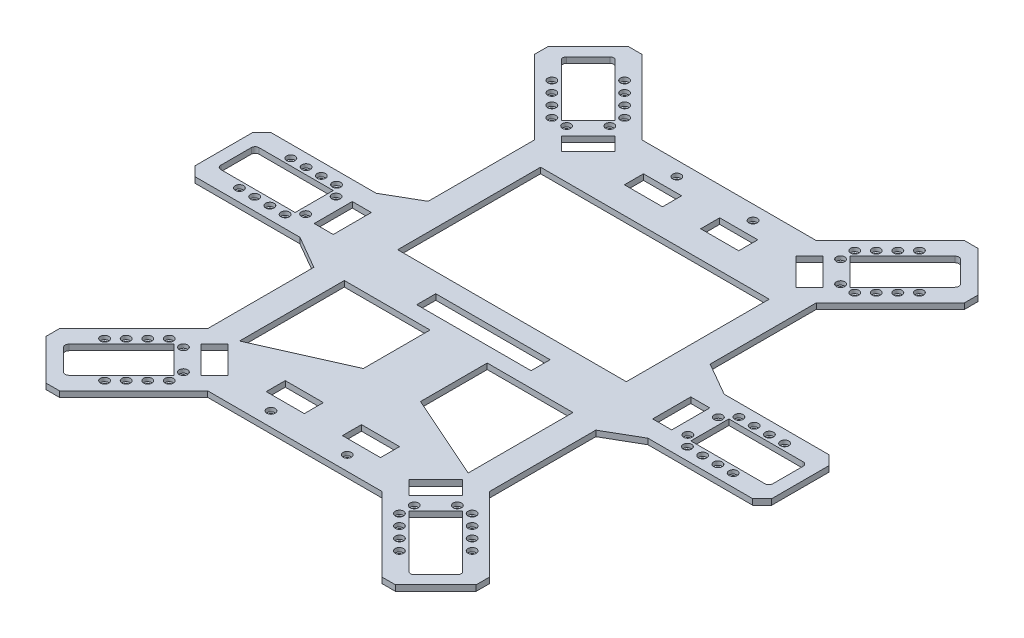
from build123d import *

# Parameters (mm, degrees)
EXTRUDE_1_DEPTH              = 3
CUT_EXTRUDE_1_REACH          = 217.134
HOLE_WIZARD_M2_2_D           = 2.4
HOLE_WIZARD_M2_2_CBORE_D     = 4.4
HOLE_WIZARD_M2_2_CBORE_DEPTH = 2
CUT_EXTRUDE_2_REACH          = 217.134
HOLE_WIZARD_M2_3_D           = 2.4
HOLE_WIZARD_M2_3_CBORE_D     = 4.4
HOLE_WIZARD_M2_3_CBORE_DEPTH = 2
MIRROR_7_COPY_1_REACH        = 217.134
MIRROR_7_COPY_2_D            = 2.4
MIRROR_7_COPY_2_CBORE_D      = 4.4
MIRROR_7_COPY_2_CBORE_DEPTH  = 2
CUT_EXTRUDE_3_REACH          = 217.134
SKETCH_19_W                  = 20
SKETCH_19_H                  = 10
SKETCH_19_W_2                = 120
SKETCH_19_H_2                = 75
SKETCH_19_W_3                = 60
CUT_EXTRUDE_4_REACH          = 217.134
SKETCH_20_W                  = 10
SKETCH_20_H                  = 20
HOLE_WIZARD_M2_4_D           = 2.4
HOLE_WIZARD_M2_4_CBORE_D     = 4.4
HOLE_WIZARD_M2_4_CBORE_DEPTH = 2


with BuildPart() as part:
    # 草图1 → 凸台-拉伸1 (new body)
    with BuildSketch(Plane(origin=(0, 0, 0), x_dir=(1, 0, 0), z_dir=(0, 1, 0))):
        Polygon((-45.715728753, 114), (45.715728753, 114), (84.606601718, 152.890872965), (91.67766953, 152.890872965), (112.890872965, 131.67766953), (112.890872965, 124.606601718), (74, 85.715728753), (74, 30), (91.320508076, 20), (146.320508076, 20), (151.320508076, 15), (151.320508076, -15), (146.320508076, -20), (91.320508076, -20), (74, -30), (74, -85.715728753), (112.890872965, -124.606601718), (112.890872965, -131.67766953), (91.67766953, -152.890872965), (84.606601718, -152.890872965), (45.715728753, -114), (-45.715728753, -114), (-84.606601718, -152.890872965), (-91.67766953, -152.890872965), (-112.890872965, -131.67766953), (-112.890872965, -124.606601718), (-74, -85.715728753), (-74, -30), (-91.320508076, -20), (-146.320508076, -20), (-151.320508076, -15), (-151.320508076, 15), (-146.320508076, 20), (-91.320508076, 20), (-74, 30), (-74, 85.715728753), (-112.890872965, 124.606601718), (-112.890872965, 131.67766953), (-91.67766953, 152.890872965), (-84.606601718, 152.890872965), align=None)
    extrude(amount=EXTRUDE_1_DEPTH)

    # 草图2 → 切除-拉伸1 (cut, up to next)
    with BuildSketch(Plane(origin=(0, 3, 0), x_dir=(1, 0, 0), z_dir=(0, 1, 0)), mode=Mode.PRIVATE) as cut_extrude_1_sk1:
        with BuildLine():
            Line((103.820508076, -10), (103.820508076, 10))
            Line((103.820508076, 10), (142.820508076, 10))
            ThreePointArc((142.820508076, 10), (144.234721638, 9.414213562), (144.820508076, 8))
            Line((144.820508076, 8), (144.820508076, -8))
            ThreePointArc((144.820508076, -8), (144.234721638, -9.414213562), (142.820508076, -10))
            Line((142.820508076, -10), (103.820508076, -10))
        make_face()
    cut_extrude_1_tool1 = extrude(cut_extrude_1_sk1.sketch, amount=-CUT_EXTRUDE_1_REACH, mode=Mode.PRIVATE) & part.part
    cut_extrude_1 = cut_extrude_1_tool1.solids().sort_by_distance((124.278435, 3, 0))[0]
    add(cut_extrude_1, mode=Mode.SUBTRACT)

    # M2 凹头盖螺钉的柱形沉头孔2 (through all)
    with Locations(Plane(origin=(100.320508076, 3, -8), x_dir=(0, 0, 1), z_dir=(0, 1, 0))):
        with Locations((0, 0), (-5.5, 5.25), (-5.5, 13.25), (-5.5, 21.25), (-5.5, 29.25), (16, 0), (21.5, 5.25), (21.5, 13.25), (21.5, 21.25), (21.5, 29.25)):
            hole_wizard_m2_2 = CounterBoreHole(HOLE_WIZARD_M2_2_D / 2, HOLE_WIZARD_M2_2_CBORE_D / 2, HOLE_WIZARD_M2_2_CBORE_DEPTH)

    # 草图10 → 切除-拉伸2 (cut, up to next)
    with BuildSketch(Plane(origin=(0, 3, 0), x_dir=(1, 0, 0), z_dir=(0, 1, 0)), mode=Mode.PRIVATE) as cut_extrude_2_sk1:
        with BuildLine():
            Line((75.767766953, 101.625631329), (61.625631329, 115.767766953))
            Line((61.625631329, 115.767766953), (89.202795796, 143.344931419))
            ThreePointArc((89.202795796, 143.344931419), (90.617009358, 143.930717857), (92.03122292, 143.344931419))
            Line((92.03122292, 143.344931419), (103.344931419, 132.03122292))
            ThreePointArc((103.344931419, 132.03122292), (103.930717857, 130.617009358), (103.344931419, 129.202795796))
            Line((103.344931419, 129.202795796), (75.767766953, 101.625631329))
        make_face()
    cut_extrude_2_tool1 = extrude(cut_extrude_2_sk1.sketch, amount=-CUT_EXTRUDE_2_REACH, mode=Mode.PRIVATE) & part.part
    cut_extrude_2 = cut_extrude_2_tool1.solids().sort_by_distance((83.162638, 3, -123.162638))[0]
    add(cut_extrude_2, mode=Mode.SUBTRACT)

    # M2 凹头盖螺钉的柱形沉头孔3 (through all)
    with Locations(Plane(origin=(60.388194462, 3, -119.480077554), x_dir=(0, 0, 1), z_dir=(0, 1, 0))):
        with Locations((0, 0), (-5.65685425, 5.65685425), (-11.313708499, 11.313708499), (-16.970562749, 16.970562749), (7.601397898, 0.176776695), (18.915106397, 11.490485194), (19.091883092, 19.091883092), (13.435028842, 24.748737342), (7.778174593, 30.405591591), (2.121320343, 36.062445841)):
            hole_wizard_m2_3 = CounterBoreHole(HOLE_WIZARD_M2_3_D / 2, HOLE_WIZARD_M2_3_CBORE_D / 2, HOLE_WIZARD_M2_3_CBORE_DEPTH)

    # 镜向5: 切除-拉伸1, M2 凹头盖螺钉的柱形沉头孔2 across plane
    add(cut_extrude_1.mirror(Plane(origin=(0, 0, 0), x_dir=(0, 0, 1), z_dir=(1, 0, 0))), mode=Mode.SUBTRACT)
    add(hole_wizard_m2_2.mirror(Plane(origin=(0, 0, 0), x_dir=(0, 0, 1), z_dir=(1, 0, 0))), mode=Mode.SUBTRACT)

    # 镜向6: 切除-拉伸2, M2 凹头盖螺钉的柱形沉头孔3 across plane
    add(cut_extrude_2.mirror(Plane(origin=(0, 0, 0), x_dir=(0, 0, 1), z_dir=(1, 0, 0))), mode=Mode.SUBTRACT)
    add(hole_wizard_m2_3.mirror(Plane(origin=(0, 0, 0), x_dir=(0, 0, 1), z_dir=(1, 0, 0))), mode=Mode.SUBTRACT)

    # 镜向7: 切除-拉伸2, M2 凹头盖螺钉的柱形沉头孔3 across plane
    add(cut_extrude_2.mirror(Plane.XY), mode=Mode.SUBTRACT)
    add(hole_wizard_m2_3.mirror(Plane.XY), mode=Mode.SUBTRACT)

    # 镜向7 copy 1 sketch → 镜向7 copy 1 (cut, up to next)
    with BuildSketch(Plane(origin=(0, 3, 0), x_dir=(-1, 0, 0), z_dir=(0, 1, 0)), mode=Mode.PRIVATE) as mirror_7_copy_1_sk1:
        with BuildLine():
            Line((75.767766953, 101.625631329), (61.625631329, 115.767766953))
            Line((61.625631329, 115.767766953), (89.202795796, 143.344931419))
            ThreePointArc((89.202795796, 143.344931419), (90.617009358, 143.930717857), (92.03122292, 143.344931419))
            Line((92.03122292, 143.344931419), (103.344931419, 132.03122292))
            ThreePointArc((103.344931419, 132.03122292), (103.930717857, 130.617009358), (103.344931419, 129.202795796))
            Line((103.344931419, 129.202795796), (75.767766953, 101.625631329))
        make_face()
    mirror_7_copy_1_tool1 = extrude(mirror_7_copy_1_sk1.sketch, amount=-MIRROR_7_COPY_1_REACH, mode=Mode.PRIVATE) & part.part
    add(mirror_7_copy_1_tool1.solids().sort_by_distance((-83.162638, 3, 123.162638))[0], mode=Mode.SUBTRACT)

    # 镜向7 copy 2 (through all)
    with Locations(Plane(origin=(-60.388194462, 3, 119.480077554), x_dir=(0, 0, -1), z_dir=(0, 1, 0))):
        with Locations((0, 0), (-5.65685425, 5.65685425), (-11.313708499, 11.313708499), (-16.970562749, 16.970562749), (7.601397898, 0.176776695), (18.915106397, 11.490485194), (19.091883092, 19.091883092), (13.435028842, 24.748737342), (7.778174593, 30.405591591), (2.121320343, 36.062445841)):
            CounterBoreHole(MIRROR_7_COPY_2_D / 2, MIRROR_7_COPY_2_CBORE_D / 2, MIRROR_7_COPY_2_CBORE_DEPTH)

    # 草图19 → 切除-拉伸3 (cut, up to next)
    with BuildSketch(Plane(origin=(0, 3, 0), x_dir=(1, 0, 0), z_dir=(0, 1, 0)), mode=Mode.PRIVATE) as cut_extrude_3_sk1:
        with Locations((-20, -94)):
            Rectangle(SKETCH_19_W, SKETCH_19_H)
    cut_extrude_3_tool1 = extrude(cut_extrude_3_sk1.sketch, amount=-CUT_EXTRUDE_3_REACH, mode=Mode.PRIVATE) & part.part
    # 草图19 → 切除-拉伸3 (cut, up to next)
    with BuildSketch(Plane(origin=(0, 3, 0), x_dir=(1, 0, 0), z_dir=(0, 1, 0)), mode=Mode.PRIVATE) as cut_extrude_3_sk2:
        with Locations((-20, 94)):
            Rectangle(SKETCH_19_W, SKETCH_19_H)
    cut_extrude_3_tool2 = extrude(cut_extrude_3_sk2.sketch, amount=-CUT_EXTRUDE_3_REACH, mode=Mode.PRIVATE) & part.part
    # 草图19 → 切除-拉伸3 (cut, up to next)
    with BuildSketch(Plane(origin=(0, 3, 0), x_dir=(1, 0, 0), z_dir=(0, 1, 0)), mode=Mode.PRIVATE) as cut_extrude_3_sk3:
        with Locations((0, 37.5)):
            Rectangle(SKETCH_19_W_2, SKETCH_19_H_2)
    cut_extrude_3_tool3 = extrude(cut_extrude_3_sk3.sketch, amount=-CUT_EXTRUDE_3_REACH, mode=Mode.PRIVATE) & part.part
    # 草图19 → 切除-拉伸3 (cut, up to next)
    with BuildSketch(Plane(origin=(0, 3, 0), x_dir=(1, 0, 0), z_dir=(0, 1, 0)), mode=Mode.PRIVATE) as cut_extrude_3_sk4:
        Polygon((-60, -28), (-15, -28), (-15, -63), (-60, -83), align=None)
    cut_extrude_3_tool4 = extrude(cut_extrude_3_sk4.sketch, amount=-CUT_EXTRUDE_3_REACH, mode=Mode.PRIVATE) & part.part
    # 草图19 → 切除-拉伸3 (cut, up to next)
    with BuildSketch(Plane(origin=(0, 3, 0), x_dir=(1, 0, 0), z_dir=(0, 1, 0)), mode=Mode.PRIVATE) as cut_extrude_3_sk5:
        with Locations((0, -15)):
            Rectangle(SKETCH_19_W_3, SKETCH_19_H)
    cut_extrude_3_tool5 = extrude(cut_extrude_3_sk5.sketch, amount=-CUT_EXTRUDE_3_REACH, mode=Mode.PRIVATE) & part.part
    # 草图19 → 切除-拉伸3 (cut, up to next)
    with BuildSketch(Plane(origin=(0, 3, 0), x_dir=(1, 0, 0), z_dir=(0, 1, 0)), mode=Mode.PRIVATE) as cut_extrude_3_sk6:
        Polygon((60, -83), (60, -28), (15, -28), (15, -63), align=None)
    cut_extrude_3_tool6 = extrude(cut_extrude_3_sk6.sketch, amount=-CUT_EXTRUDE_3_REACH, mode=Mode.PRIVATE) & part.part
    # 草图19 → 切除-拉伸3 (cut, up to next)
    with BuildSketch(Plane(origin=(0, 3, 0), x_dir=(1, 0, 0), z_dir=(0, 1, 0)), mode=Mode.PRIVATE) as cut_extrude_3_sk7:
        with Locations((20, 94)):
            Rectangle(SKETCH_19_W, SKETCH_19_H)
    cut_extrude_3_tool7 = extrude(cut_extrude_3_sk7.sketch, amount=-CUT_EXTRUDE_3_REACH, mode=Mode.PRIVATE) & part.part
    # 草图19 → 切除-拉伸3 (cut, up to next)
    with BuildSketch(Plane(origin=(0, 3, 0), x_dir=(1, 0, 0), z_dir=(0, 1, 0)), mode=Mode.PRIVATE) as cut_extrude_3_sk8:
        with Locations((20, -94)):
            Rectangle(SKETCH_19_W, SKETCH_19_H)
    cut_extrude_3_tool8 = extrude(cut_extrude_3_sk8.sketch, amount=-CUT_EXTRUDE_3_REACH, mode=Mode.PRIVATE) & part.part
    add(cut_extrude_3_tool1.solids().sort_by_distance((-20, 3, 94))[0], mode=Mode.SUBTRACT)
    add(cut_extrude_3_tool2.solids().sort_by_distance((-20, 3, -94))[0], mode=Mode.SUBTRACT)
    add(cut_extrude_3_tool3.solids().sort_by_distance((0, 3, -37.5))[0], mode=Mode.SUBTRACT)
    add(cut_extrude_3_tool4.solids().sort_by_distance((-39.166667, 3, 50.87037))[0], mode=Mode.SUBTRACT)
    add(cut_extrude_3_tool5.solids().sort_by_distance((0, 3, 15))[0], mode=Mode.SUBTRACT)
    add(cut_extrude_3_tool6.solids().sort_by_distance((39.166667, 3, 50.87037))[0], mode=Mode.SUBTRACT)
    add(cut_extrude_3_tool7.solids().sort_by_distance((20, 3, -94))[0], mode=Mode.SUBTRACT)
    add(cut_extrude_3_tool8.solids().sort_by_distance((20, 3, 94))[0], mode=Mode.SUBTRACT)

    # 草图20 → 切除-拉伸4 (cut, up to next)
    with BuildSketch(Plane(origin=(0, 3, 0), x_dir=(1, 0, 0), z_dir=(0, 1, 0)), mode=Mode.PRIVATE) as cut_extrude_4_sk1:
        Polygon((-47.483495706, 101.625631329), (-54.554563517, 108.696699141), (-68.696699141, 94.554563517), (-61.625631329, 87.483495706), align=None)
    cut_extrude_4_tool1 = extrude(cut_extrude_4_sk1.sketch, amount=-CUT_EXTRUDE_4_REACH, mode=Mode.PRIVATE) & part.part
    # 草图20 → 切除-拉伸4 (cut, up to next)
    with BuildSketch(Plane(origin=(0, 3, 0), x_dir=(1, 0, 0), z_dir=(0, 1, 0)), mode=Mode.PRIVATE) as cut_extrude_4_sk2:
        with Locations((-88.820508076, 0)):
            Rectangle(SKETCH_20_W, SKETCH_20_H)
    cut_extrude_4_tool2 = extrude(cut_extrude_4_sk2.sketch, amount=-CUT_EXTRUDE_4_REACH, mode=Mode.PRIVATE) & part.part
    # 草图20 → 切除-拉伸4 (cut, up to next)
    with BuildSketch(Plane(origin=(0, 3, 0), x_dir=(1, 0, 0), z_dir=(0, 1, 0)), mode=Mode.PRIVATE) as cut_extrude_4_sk3:
        Polygon((47.483495706, 101.625631329), (54.554563517, 108.696699141), (68.696699141, 94.554563517), (61.625631329, 87.483495706), align=None)
    cut_extrude_4_tool3 = extrude(cut_extrude_4_sk3.sketch, amount=-CUT_EXTRUDE_4_REACH, mode=Mode.PRIVATE) & part.part
    # 草图20 → 切除-拉伸4 (cut, up to next)
    with BuildSketch(Plane(origin=(0, 3, 0), x_dir=(1, 0, 0), z_dir=(0, 1, 0)), mode=Mode.PRIVATE) as cut_extrude_4_sk4:
        with Locations((88.820508076, 0)):
            Rectangle(SKETCH_20_W, SKETCH_20_H)
    cut_extrude_4_tool4 = extrude(cut_extrude_4_sk4.sketch, amount=-CUT_EXTRUDE_4_REACH, mode=Mode.PRIVATE) & part.part
    # 草图20 → 切除-拉伸4 (cut, up to next)
    with BuildSketch(Plane(origin=(0, 3, 0), x_dir=(1, 0, 0), z_dir=(0, 1, 0)), mode=Mode.PRIVATE) as cut_extrude_4_sk5:
        Polygon((61.625631329, -87.483495706), (68.696699141, -94.554563517), (54.554563517, -108.696699141), (47.483495706, -101.625631329), align=None)
    cut_extrude_4_tool5 = extrude(cut_extrude_4_sk5.sketch, amount=-CUT_EXTRUDE_4_REACH, mode=Mode.PRIVATE) & part.part
    # 草图20 → 切除-拉伸4 (cut, up to next)
    with BuildSketch(Plane(origin=(0, 3, 0), x_dir=(1, 0, 0), z_dir=(0, 1, 0)), mode=Mode.PRIVATE) as cut_extrude_4_sk6:
        Polygon((-47.483495706, -101.625631329), (-54.554563517, -108.696699141), (-68.696699141, -94.554563517), (-61.625631329, -87.483495706), align=None)
    cut_extrude_4_tool6 = extrude(cut_extrude_4_sk6.sketch, amount=-CUT_EXTRUDE_4_REACH, mode=Mode.PRIVATE) & part.part
    add(cut_extrude_4_tool1.solids().sort_by_distance((-58.090097, 3, -98.090097))[0], mode=Mode.SUBTRACT)
    add(cut_extrude_4_tool2.solids().sort_by_distance((-88.820508, 3, 0))[0], mode=Mode.SUBTRACT)
    add(cut_extrude_4_tool3.solids().sort_by_distance((58.090097, 3, -98.090097))[0], mode=Mode.SUBTRACT)
    add(cut_extrude_4_tool4.solids().sort_by_distance((88.820508, 3, 0))[0], mode=Mode.SUBTRACT)
    add(cut_extrude_4_tool5.solids().sort_by_distance((58.090097, 3, 98.090097))[0], mode=Mode.SUBTRACT)
    add(cut_extrude_4_tool6.solids().sort_by_distance((-58.090097, 3, 98.090097))[0], mode=Mode.SUBTRACT)

    # M2 凹头盖螺钉的柱形沉头孔4 (through all)
    with Locations(Plane(origin=(-20, 3, -106.5), x_dir=(0, 0, 1), z_dir=(0, 1, 0))):
        with Locations((0, 0), (0, 40), (213, 0), (213, 40)):
            CounterBoreHole(HOLE_WIZARD_M2_4_D / 2, HOLE_WIZARD_M2_4_CBORE_D / 2, HOLE_WIZARD_M2_4_CBORE_DEPTH)


solid = part.part
